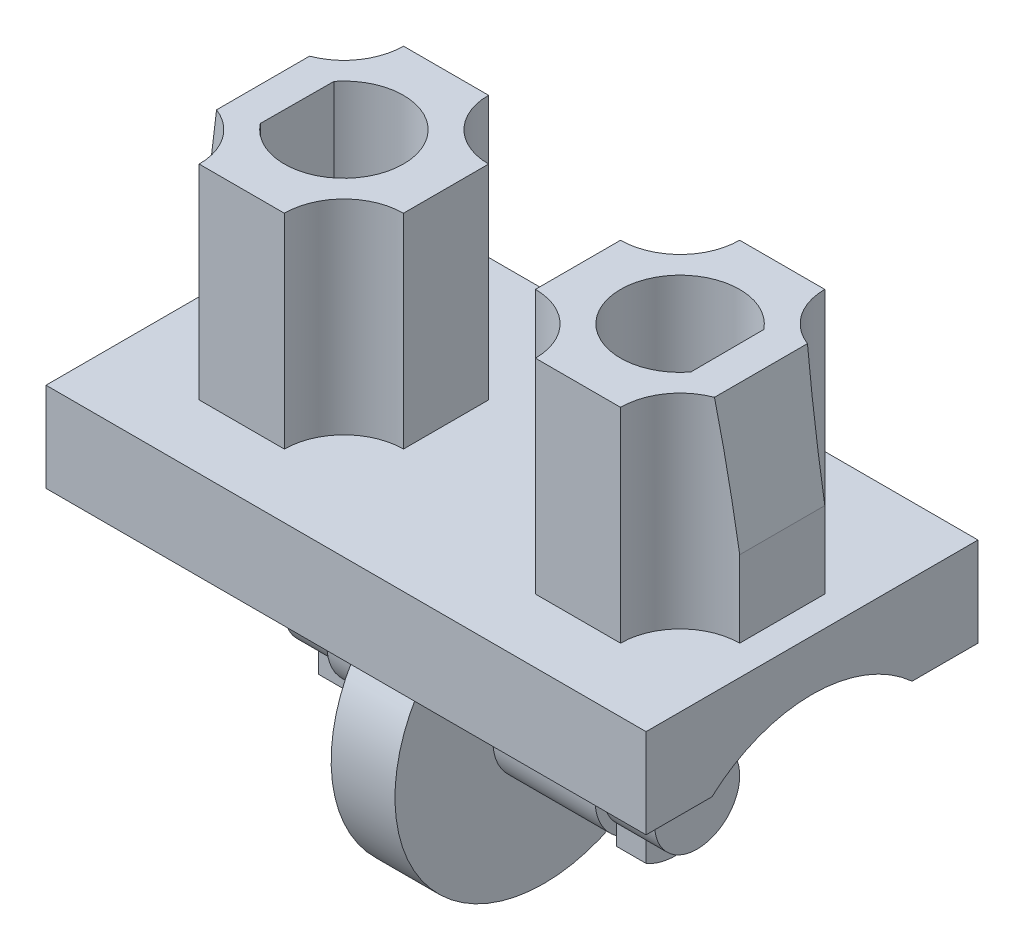
from build123d import *

# Parameters (mm, degrees)
HIP_BASE_EXTRUDED_BOSS_BASE_DEPTH      = 7.05
SKETCH1_3_R                            = 3.5
LEG_JOINT_EXTRUDED_BOSS_BASE_DEPTH     = 0.75
SKETCH2_R                              = 1.2
LEG_PEG_EXTRUDED_BOSS_BASE_DEPTH       = 2.4
LEG_PEG_INNER_EXTRUDED_BOSS_BASE_DEPTH = 1.2
LEG_LOCK_EXTRUDED_DETAIL_DEPTH         = 0.7
HIP_PEG_EXTRUDED_BOSS_BASE_DEPTH       = 4.8
HIP_CAVITY_EXTRUDED_CUT_DEPTH          = 4.8
HIP_PEG_CHAMFER_DEPTH                  = 12.495760088


with BuildPart() as part:
    # Sketch1 → Hip Base - Extruded Boss/Base (new, symmetric)
    with BuildSketch(Plane(origin=(0, 0, 0), x_dir=(0, 0, -1), z_dir=(1, 0, 0))):
        with BuildLine():
            ThreePointArc((-2.351256126, -2.107396168), (0, -1.2), (2.351256126, -2.107396168))
            Line((2.351256126, -2.107396168), (3.9, -2.107396168))
            Line((3.9, -2.107396168), (3.9, -0.007396168))
            Line((3.9, -0.007396168), (-3.9, -0.007396168))
            Line((-3.9, -0.007396168), (-3.9, -2.107396168))
            Line((-3.9, -2.107396168), (-2.351256126, -2.107396168))
        make_face()
    extrude(amount=HIP_BASE_EXTRUDED_BOSS_BASE_DEPTH, both=True)

    # Sketch1<3> → Leg Joint - Extruded Boss/Base (add, symmetric)
    with BuildSketch(Plane(origin=(0, 0, 0), x_dir=(0, 0, -1), z_dir=(1, 0, 0))):
        with Locations((0, -4.7)):
            Circle(SKETCH1_3_R)
    extrude(amount=LEG_JOINT_EXTRUDED_BOSS_BASE_DEPTH, both=True)

    # Sketch2 → Leg Peg - Extruded Boss/Base (add)
    with BuildSketch(Plane(origin=(0.75, 0, 0), x_dir=(0, 0, -1), z_dir=(1, 0, 0))):
        with Locations((0, -4.7)):
            Circle(SKETCH2_R)
    leg_peg_extruded_boss_base = extrude(amount=LEG_PEG_EXTRUDED_BOSS_BASE_DEPTH)

    # Sketch3 → Leg Peg Inner - Extruded Boss/Base (add)
    with BuildSketch(Plane(origin=(3.15, 0, 0), x_dir=(0, 0, -1), z_dir=(1, 0, 0))):
        with BuildLine():
            Line((-0.661437828, -3.95), (0.661437828, -3.95))
            ThreePointArc((0.661437828, -3.95), (0, -5.7), (-0.661437828, -3.95))
        make_face()
    leg_peg_inner_extruded_boss_base = extrude(amount=LEG_PEG_INNER_EXTRUDED_BOSS_BASE_DEPTH)

    # Sketch4 → Leg Lock - Extruded Detail (add)
    with BuildSketch(Plane(origin=(3.15, 0, 0), x_dir=(0, 0, -1), z_dir=(1, 0, 0))):
        with BuildLine():
            Line((-0.7, -5.8892855), (-0.7, -5.414142843))
            ThreePointArc((-0.7, -5.414142843), (0, -5.7), (0.7, -5.414142843))
            Line((0.7, -5.414142843), (0.7, -5.8892855))
            ThreePointArc((0.7, -5.8892855), (0, -6.08), (-0.7, -5.8892855))
        make_face()
    leg_lock_extruded_detail = extrude(amount=LEG_LOCK_EXTRUDED_DETAIL_DEPTH)

    # Sketch5 → Hip Peg - Extruded Boss/Base (add)
    with BuildSketch(Plane(origin=(0, -0.007396168, 0), x_dir=(1, 0, 0), z_dir=(0, 1, 0))):
        with BuildLine():
            ThreePointArc((1.55, -1), (2.539949494, -1.410050506), (2.95, -2.4))
            Line((2.95, -2.4), (4.95, -2.4))
            ThreePointArc((4.95, -2.4), (5.360050506, -1.410050506), (6.35, -1))
            Line((6.35, -1), (6.35, 1))
            ThreePointArc((6.35, 1), (5.360050506, 1.410050506), (4.95, 2.4))
            Line((4.95, 2.4), (2.95, 2.4))
            ThreePointArc((2.95, 2.4), (2.539949494, 1.410050506), (1.55, 1))
            Line((1.55, 1), (1.55, -1))
        make_face()
    hip_peg_extruded_boss_base = extrude(amount=HIP_PEG_EXTRUDED_BOSS_BASE_DEPTH)

    # Sketch6 → Hip Cavity - Extruded Cut (cut)
    with BuildSketch(Plane(origin=(0, 4.792603832, 0), x_dir=(1, 0, 0), z_dir=(0, 1, 0))):
        with BuildLine():
            Line((5.058021727, -0.855738191), (5.05, 0.866025404))
            ThreePointArc((5.05, 0.866025404), (2.550015194, -0.006522554), (5.058021727, -0.855738191))
        make_face()
    hip_cavity_extruded_cut = extrude(amount=-HIP_CAVITY_EXTRUDED_CUT_DEPTH, mode=Mode.SUBTRACT)

    # Sketch7 → Hip Peg Chamfer (cut, symmetric)
    with BuildSketch(Plane.XY):
        Polygon((6.35, 4.792603832), (6.35, 1.792603832), (5.85, 4.792603832), align=None)
    hip_peg_chamfer = extrude(amount=HIP_PEG_CHAMFER_DEPTH, both=True, mode=Mode.SUBTRACT)

    # Mirror1: Leg Peg - Extruded Boss/Base, Leg Peg Inner - Extruded Boss/Base, Leg Lock - Extruded Detail, Hip Peg - Extruded Boss/Base, Hip Cavity - Extruded Cut, Hip Peg Chamfer across plane
    add(leg_peg_extruded_boss_base.mirror(Plane(origin=(0, 0, 0), x_dir=(0, 0, 1), z_dir=(1, 0, 0))))
    add(leg_peg_inner_extruded_boss_base.mirror(Plane(origin=(0, 0, 0), x_dir=(0, 0, 1), z_dir=(1, 0, 0))))
    add(leg_lock_extruded_detail.mirror(Plane(origin=(0, 0, 0), x_dir=(0, 0, 1), z_dir=(1, 0, 0))))
    add(hip_peg_extruded_boss_base.mirror(Plane(origin=(0, 0, 0), x_dir=(0, 0, 1), z_dir=(1, 0, 0))))
    add(hip_cavity_extruded_cut.mirror(Plane(origin=(0, 0, 0), x_dir=(0, 0, 1), z_dir=(1, 0, 0))), mode=Mode.SUBTRACT)
    add(hip_peg_chamfer.mirror(Plane(origin=(0, 0, 0), x_dir=(0, 0, 1), z_dir=(1, 0, 0))), mode=Mode.SUBTRACT)


solid = part.part
